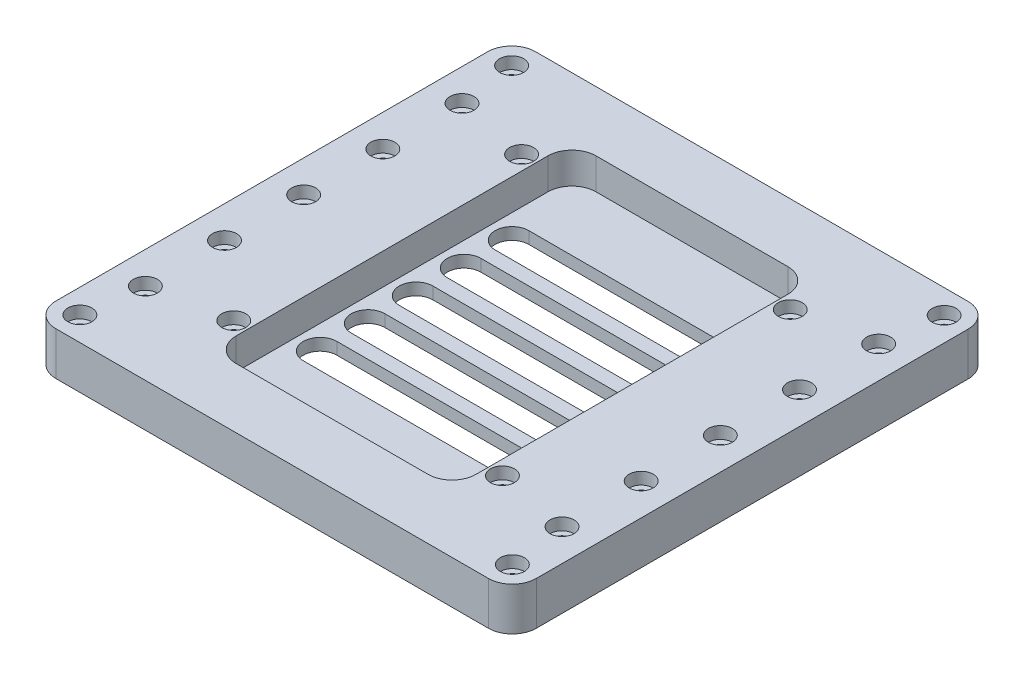
from build123d import *

# Parameters (mm, degrees)
SKETCH1_W           = 200.3
SKETCH1_H           = 200
SKETCH1_R           = 2.5
BOSS_EXTRUDE1_DEPTH = 18
FILLET1_R           = 10
SKETCH2_R           = 5
CUT_EXTRUDE1_DEPTH  = 5
SKETCH3_W           = 100
SKETCH3_H           = 150
CUT_EXTRUDE2_DEPTH  = 13
FILLET2_R           = 10
SKETCH4_R           = 5
CUT_EXTRUDE3_DEPTH  = 5
SKETCH5_R           = 2.5
CUT_EXTRUDE4_DEPTH  = 143.123265161


with BuildPart() as part:
    # Sketch1 → Boss-Extrude1 (new body)
    with BuildSketch(Plane(origin=(0, 0, 0), x_dir=(1, 0, 0), z_dir=(0, 1, 0))):
        Rectangle(SKETCH1_W, SKETCH1_H)
        with Locations(Location((86.84999973, 0, 0), (0, 0, 270))):
            Circle(SKETCH1_R, mode=Mode.SUBTRACT)
        with Locations(Location((86.84999973, 33, 0), (0, 0, 270))):
            Circle(SKETCH1_R, mode=Mode.SUBTRACT)
        with Locations(Location((86.84999973, 66, 0), (0, 0, 270))):
            Circle(SKETCH1_R, mode=Mode.SUBTRACT)
        with Locations(Location((86.84999973, -66, 0), (0, 0, 90))):
            Circle(SKETCH1_R, mode=Mode.SUBTRACT)
        with Locations(Location((86.84999973, -33, 0), (0, 0, 90))):
            Circle(SKETCH1_R, mode=Mode.SUBTRACT)
        with Locations(Location((-86.84999973, 66, 0), (0, 0, 90))):
            Circle(SKETCH1_R, mode=Mode.SUBTRACT)
        with Locations(Location((-86.84999973, 33, 0), (0, 0, 90))):
            Circle(SKETCH1_R, mode=Mode.SUBTRACT)
        with Locations(Location((-86.84999973, 0, 0), (0, 0, 90))):
            Circle(SKETCH1_R, mode=Mode.SUBTRACT)
        with Locations(Location((-86.84999973, -33, 0), (0, 0, 270))):
            Circle(SKETCH1_R, mode=Mode.SUBTRACT)
        with Locations(Location((-86.84999973, -66, 0), (0, 0, 270))):
            Circle(SKETCH1_R, mode=Mode.SUBTRACT)
        with Locations(Location((56, -60, 0), (0, 0, 270))):
            Circle(SKETCH1_R, mode=Mode.SUBTRACT)
        with Locations(Location((-56, -60, 0), (0, 0, 90))):
            Circle(SKETCH1_R, mode=Mode.SUBTRACT)
        with Locations(Location((-56, 60, 0), (0, 0, 270))):
            Circle(SKETCH1_R, mode=Mode.SUBTRACT)
        with Locations(Location((56, 60, 0), (0, 0, 90))):
            Circle(SKETCH1_R, mode=Mode.SUBTRACT)
        with BuildLine():
            Line((40, 33), (-40, 33))
            ThreePointArc((-40, 33), (-47, 40), (-40, 47))
            Line((-40, 47), (40, 47))
            ThreePointArc((40, 47), (47, 40), (40, 33))
        make_face(mode=Mode.SUBTRACT)
        with BuildLine():
            Line((40, 13), (-40, 13))
            ThreePointArc((-40, 13), (-47, 20), (-40, 27))
            Line((-40, 27), (40, 27))
            ThreePointArc((40, 27), (47, 20), (40, 13))
        make_face(mode=Mode.SUBTRACT)
        with BuildLine():
            Line((40, -7), (-40, -7))
            ThreePointArc((-40, -7), (-47, 0), (-40, 7))
            Line((-40, 7), (40, 7))
            ThreePointArc((40, 7), (47, 0), (40, -7))
        make_face(mode=Mode.SUBTRACT)
        with BuildLine():
            Line((40, -27), (-40, -27))
            ThreePointArc((-40, -27), (-47, -20), (-40, -13))
            Line((-40, -13), (40, -13))
            ThreePointArc((40, -13), (47, -20), (40, -27))
        make_face(mode=Mode.SUBTRACT)
        with BuildLine():
            Line((40, -47), (-40, -47))
            ThreePointArc((-40, -47), (-47, -40), (-40, -33))
            Line((-40, -33), (40, -33))
            ThreePointArc((40, -33), (47, -40), (40, -47))
        make_face(mode=Mode.SUBTRACT)
    extrude(amount=BOSS_EXTRUDE1_DEPTH)

    # Fillet1
    fillet1_edges = [part.edges().sort_by_distance(p)[0] for p in [
        (100.15, 9, 100),
        (-100.15, 9, 100),
        (-100.15, 9, -100),
        (100.15, 9, -100),
    ]]
    fillet(fillet1_edges, radius=FILLET1_R)

    # Sketch2 → Cut-Extrude1 (cut)
    with BuildSketch(Plane(origin=(0, 18, 0), x_dir=(1, 0, 0), z_dir=(0, 1, 0))):
        with Locations(Location((-86.84999973, 66, 0), (0, 0, 270))):
            Circle(SKETCH2_R)
        with Locations(Location((-86.84999973, 33, 0), (0, 0, 270))):
            Circle(SKETCH2_R)
        with Locations(Location((-86.84999973, 0, 0), (0, 0, 270))):
            Circle(SKETCH2_R)
        with Locations(Location((-86.84999973, -33, 0), (0, 0, 270))):
            Circle(SKETCH2_R)
        with Locations(Location((-86.84999973, -66, 0), (0, 0, 270))):
            Circle(SKETCH2_R)
        with Locations(Location((86.84999973, -66, 0), (0, 0, 90))):
            Circle(SKETCH2_R)
        with Locations(Location((86.84999973, -33, 0), (0, 0, 90))):
            Circle(SKETCH2_R)
        with Locations(Location((86.84999973, 0, 0), (0, 0, 90))):
            Circle(SKETCH2_R)
        with Locations(Location((86.84999973, 33, 0), (0, 0, 90))):
            Circle(SKETCH2_R)
        with Locations(Location((86.84999973, 66, 0), (0, 0, 90))):
            Circle(SKETCH2_R)
        with Locations(Location((-56, 60, 0), (0, 0, 270))):
            Circle(SKETCH2_R)
        with Locations(Location((-56, -60, 0), (0, 0, 90))):
            Circle(SKETCH2_R)
        with Locations(Location((56, -60, 0), (0, 0, 270))):
            Circle(SKETCH2_R)
        with Locations(Location((56, 60, 0), (0, 0, 90))):
            Circle(SKETCH2_R)
    extrude(amount=-CUT_EXTRUDE1_DEPTH, mode=Mode.SUBTRACT)

    # Sketch3 → Cut-Extrude2 (cut)
    with BuildSketch(Plane(origin=(0, 18, 0), x_dir=(1, 0, 0), z_dir=(0, 1, 0))):
        Rectangle(SKETCH3_W, SKETCH3_H)
    extrude(amount=-CUT_EXTRUDE2_DEPTH, mode=Mode.SUBTRACT)

    # Fillet2
    fillet2_edges = [part.edges().sort_by_distance(p)[0] for p in [
        (50, 11.5, -75),
        (50, 11.5, 75),
        (-50, 11.5, 75),
        (-50, 11.5, -75),
    ]]
    fillet(fillet2_edges, radius=FILLET2_R)

    # Sketch4 → Cut-Extrude3 (cut)
    with BuildSketch(Plane(origin=(0, 18, 0), x_dir=(1, 0, 0), z_dir=(0, 1, 0))):
        with Locations(Location((-90.15, -90, 0), (0, 0, 270))):
            Circle(SKETCH4_R)
        with Locations(Location((-90.15, 90, 0), (0, 0, 270))):
            Circle(SKETCH4_R)
        with Locations(Location((90.15, 90, 0), (0, 0, 270))):
            Circle(SKETCH4_R)
        with Locations(Location((90.15, -90, 0), (0, 0, 270))):
            Circle(SKETCH4_R)
    extrude(amount=-CUT_EXTRUDE3_DEPTH, mode=Mode.SUBTRACT)

    # Sketch5 → Cut-Extrude4 (cut, through all)
    with BuildSketch(Plane(origin=(0, 13, 0), x_dir=(1, 0, 0), z_dir=(0, 1, 0))):
        with Locations(Location((-90.15, -90, 0), (0, 0, 270))):
            Circle(SKETCH5_R)
        with Locations(Location((-90.15, 90, 0), (0, 0, 270))):
            Circle(SKETCH5_R)
        with Locations(Location((90.15, 90, 0), (0, 0, 270))):
            Circle(SKETCH5_R)
        with Locations(Location((90.15, -90, 0), (0, 0, 270))):
            Circle(SKETCH5_R)
    extrude(amount=-CUT_EXTRUDE4_DEPTH, mode=Mode.SUBTRACT)


solid = part.part
